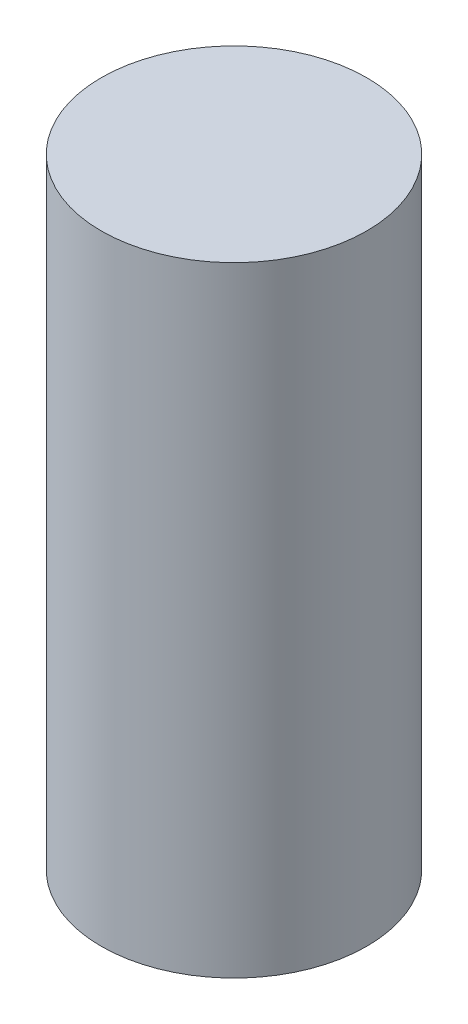
from build123d import *

# Parameters (mm, degrees)
TOPPING_AYAR_MIL_3_START = 12
SKETCH1_R                = 6
TOPPING_AYAR_MIL_3_DEPTH = 28


with BuildPart() as part:
    # Sketch1 → TOPPING_ayar_mil_3 (new body)
    with BuildSketch(Plane(origin=(0, 0, 0), x_dir=(1, 0, 0), z_dir=(0, 1, 0)).offset(TOPPING_AYAR_MIL_3_START)):
        with Locations(Location((50, 770, 0), (0, 0, 270))):
            Circle(SKETCH1_R)
    extrude(amount=TOPPING_AYAR_MIL_3_DEPTH)


solid = part.part
